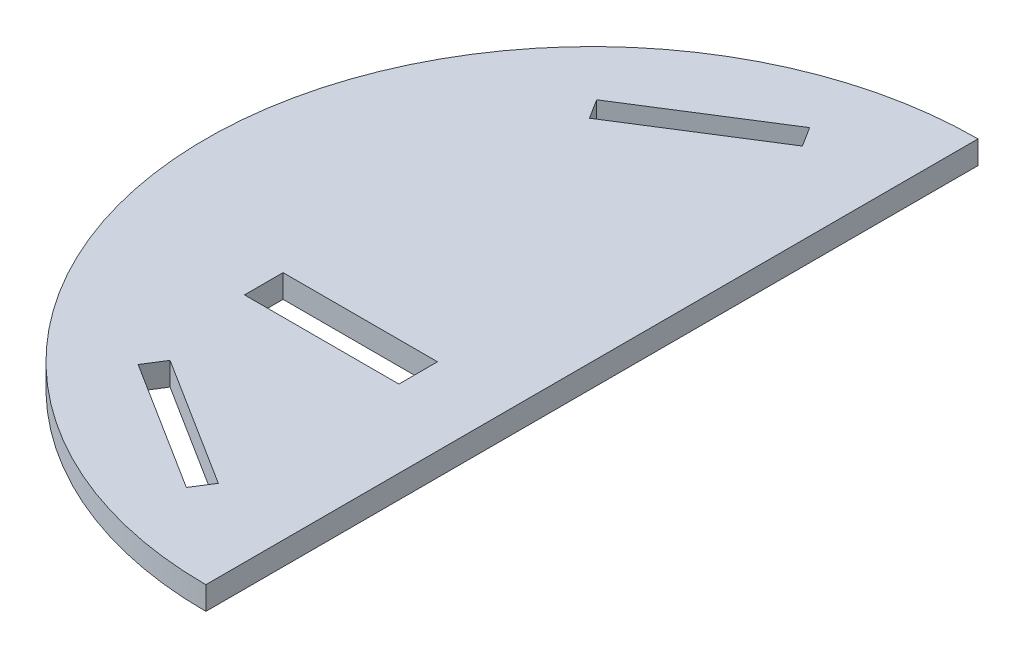
from build123d import *

# Parameters (mm, degrees)
EXTRUDE_1_DEPTH     = 3
CUT_EXTRUDE_1_DEPTH = 5
CUT_EXTRUDE_2_DEPTH = 5


with BuildPart() as part:
    # 草图1 → 凸台-拉伸1 (new body)
    with BuildSketch(Plane(origin=(0, 0, 0), x_dir=(1, 0, 0), z_dir=(0, 1, 0))):
        with BuildLine():
            Line((0, 50), (0, -50))
            ThreePointArc((0, -50), (-50, 0), (0, 50))
        make_face()
    extrude(amount=EXTRUDE_1_DEPTH)

    # 草图3 → 切除-拉伸1 (cut)
    with BuildSketch(Plane(origin=(0, 3, 0), x_dir=(1, 0, 0), z_dir=(0, 1, 0))):
        Polygon((-27.479570649, 27.155271417), (-10.562944149, 37.824280175), (-12.163295463, 40.36177415), (-29.079921962, 29.692765392), align=None)
        Polygon((-29.079921962, -29.692765392), (-27.479570649, -27.155271417), (-10.562944149, -37.824280175), (-12.163295463, -40.36177415), align=None)
    extrude(amount=-CUT_EXTRUDE_1_DEPTH, mode=Mode.SUBTRACT)

    # 草图4 → 切除-拉伸2 (cut)
    with BuildSketch(Plane(origin=(0, 3, 0), x_dir=(1, 0, 0), z_dir=(0, 1, 0))):
        Polygon((-29.442581692, -10), (-30, -10), (-30, -15), (-10, -15), (-10, -10), align=None)
    extrude(amount=-CUT_EXTRUDE_2_DEPTH, mode=Mode.SUBTRACT)


solid = part.part
